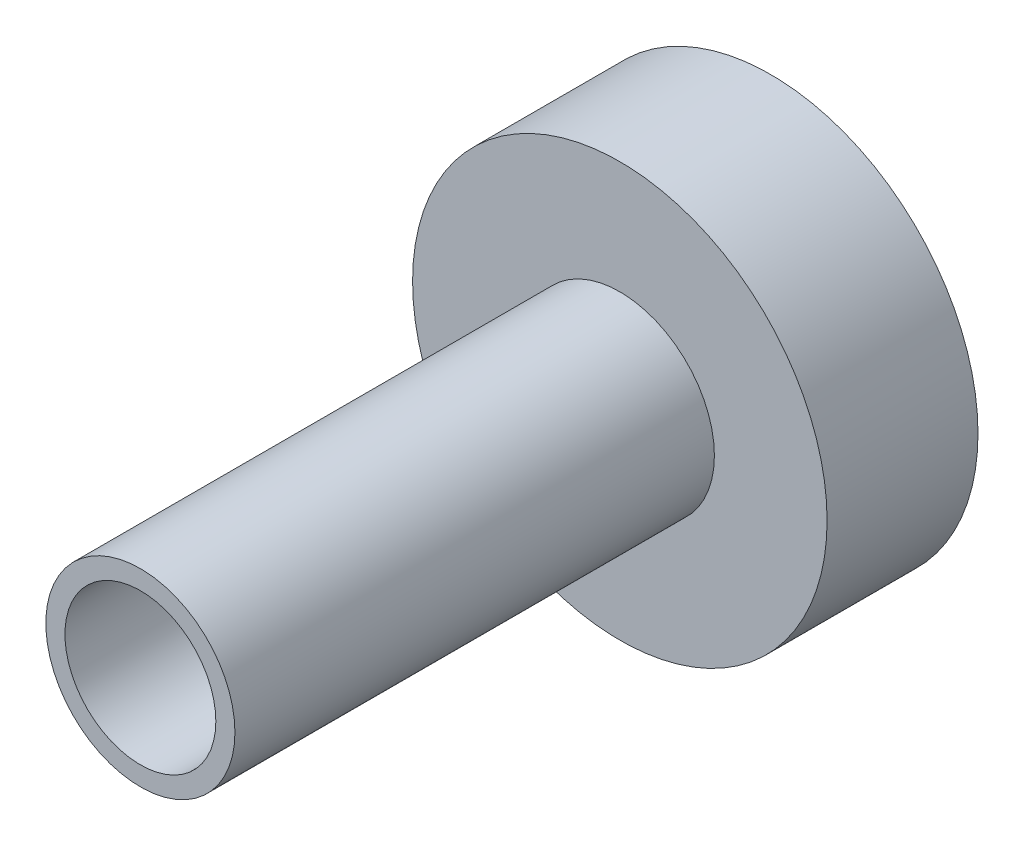
from build123d import *

# Parameters (mm, degrees)
SKETCH1_R           = 10.85
SKETCH1_R_2         = 3.95
BOSS_EXTRUDE1_DEPTH = 33
CUT_EXTRUDE1_START  = -25.1
SKETCH2_R           = 10.85
SKETCH2_R_2         = 4.95
CUT_EXTRUDE1_DEPTH  = 25.1


with BuildPart() as part:
    # Sketch1 → Boss-Extrude1 (new body)
    with BuildSketch(Plane.XY):
        Circle(SKETCH1_R)
        Circle(SKETCH1_R_2, mode=Mode.SUBTRACT)
    extrude(amount=BOSS_EXTRUDE1_DEPTH)

    # Sketch2 → Cut-Extrude1 (cut)
    with BuildSketch(Plane.XY.offset(33).offset(CUT_EXTRUDE1_START)):
        Circle(SKETCH2_R)
        Circle(SKETCH2_R_2, mode=Mode.SUBTRACT)
    extrude(amount=CUT_EXTRUDE1_DEPTH, mode=Mode.SUBTRACT)


solid = part.part
